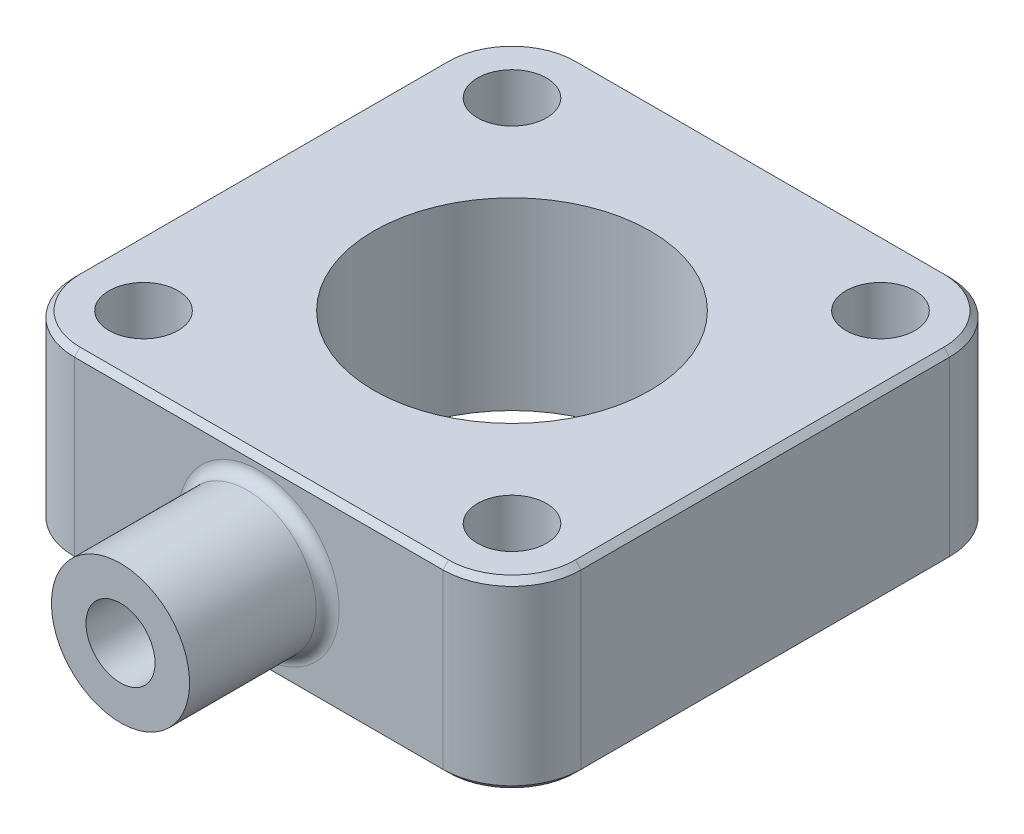
from build123d import *

# Parameters (mm, degrees)
SKETCH1_R           = 1.5
SKETCH1_R_2         = 6
BOSS_EXTRUDE1_DEPTH = 4
BOSS_EXTRUDE2_START = 11
SKETCH2_R           = 3
BOSS_EXTRUDE2_DEPTH = 6
SKETCH3_R           = 1.5
CUT_EXTRUDE1_DEPTH  = 16
CHAMFER1_SIZE       = 0.25
FILLET1_R           = 0.5


with BuildPart() as part:
    # Sketch1 → Boss-Extrude1 (new, symmetric)
    with BuildSketch(Plane(origin=(0, 0, 0), x_dir=(1, 0, 0), z_dir=(0, 1, 0))):
        with BuildLine():
            Line((8, -11), (-8, -11))
            ThreePointArc((-8, -11), (-10.121320344, -10.121320344), (-11, -8))
            Line((-11, -8), (-11, 8))
            ThreePointArc((-11, 8), (-10.121320344, 10.121320344), (-8, 11))
            Line((-8, 11), (8, 11))
            ThreePointArc((8, 11), (10.121320344, 10.121320344), (11, 8))
            Line((11, 8), (11, -8))
            ThreePointArc((11, -8), (10.121320344, -10.121320344), (8, -11))
        make_face()
        with Locations(Location((-8, 8, 0), (0, 0, 270))):
            Circle(SKETCH1_R, mode=Mode.SUBTRACT)
        with Locations(Location((8, 8, 0), (0, 0, 270))):
            Circle(SKETCH1_R, mode=Mode.SUBTRACT)
        with Locations(Location((8, -8, 0), (0, 0, 270))):
            Circle(SKETCH1_R, mode=Mode.SUBTRACT)
        with Locations(Location((-8, -8, 0), (0, 0, 270))):
            Circle(SKETCH1_R, mode=Mode.SUBTRACT)
        with Locations(Location((0, 0, 0), (0, 0, 270))):
            Circle(SKETCH1_R_2, mode=Mode.SUBTRACT)
    extrude(amount=BOSS_EXTRUDE1_DEPTH, both=True)

    # Sketch2 → Boss-Extrude2 (add)
    with BuildSketch(Plane.XY.offset(BOSS_EXTRUDE2_START)):
        with Locations(Location((0, 0, 0), (0, 0, 180))):
            Circle(SKETCH2_R)
    extrude(amount=BOSS_EXTRUDE2_DEPTH)

    # Sketch3 → Cut-Extrude1 (cut)
    with BuildSketch(Plane.XY.offset(17)):
        Circle(SKETCH3_R)
    extrude(amount=-CUT_EXTRUDE1_DEPTH, mode=Mode.SUBTRACT)

    # Chamfer1
    chamfer1_edges = [part.edges().sort_by_distance(p)[0] for p in [
        (0, -4, -11),
        (10.121320344, -4, -10.121320344),
        (11, -4, 0),
        (10.121320344, -4, 10.121320344),
        (10.121320344, 4, -10.121320344),
        (0, 4, -11),
        (-10.121320344, 4, -10.121320344),
        (-11, 4, 0),
        (-10.121320344, 4, 10.121320344),
        (0, 4, 11),
        (10.121320344, 4, 10.121320344),
        (0, -4, 11),
        (11, 4, 0),
        (-10.121320344, -4, 10.121320344),
        (-11, -4, 0),
        (-10.121320344, -4, -10.121320344),
    ]]
    chamfer(chamfer1_edges, length=CHAMFER1_SIZE)

    # Fillet1
    fillet1_edges = [part.edges().sort_by_distance(p)[0] for p in [
        (3, 0, 11),
    ]]
    fillet(fillet1_edges, radius=FILLET1_R)


solid = part.part
